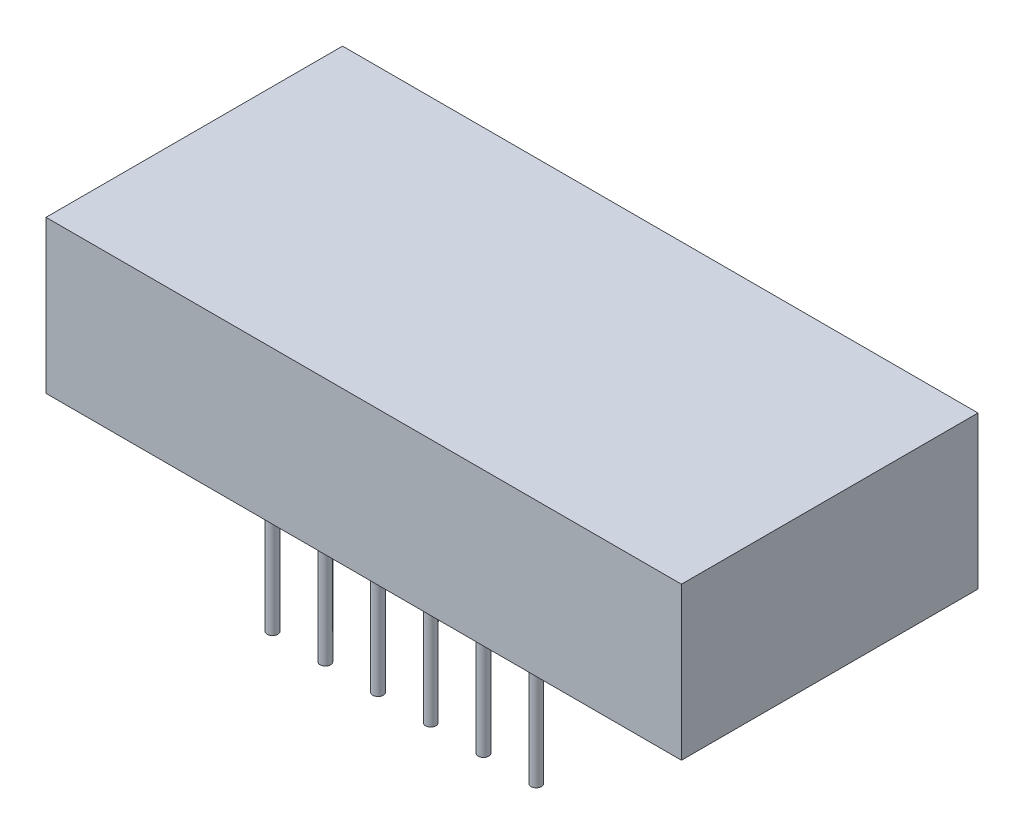
from build123d import *

# Parameters (mm, degrees)
SKETCH_1_W      = 30
SKETCH_1_H      = 14
EXTRUDE_1_DEPTH = 7.2
SKETCH_2_R      = 0.25
EXTRUDE_2_DEPTH = 6.3


with BuildPart() as part:
    # 草图1 → 拉伸1 (new body)
    with BuildSketch(Plane(origin=(0, 0, 0), x_dir=(1, 0, 0), z_dir=(0, 1, 0))):
        Rectangle(SKETCH_1_W, SKETCH_1_H)
    extrude(amount=EXTRUDE_1_DEPTH)

    # 草图2 → 拉伸2 (add)
    with BuildSketch(Plane.XZ):
        with Locations(Location((6.224686657, 5.08, 0), (0, 0, 90))):
            Circle(SKETCH_2_R)
        with Locations(Location((3.734811994, 5.08, 0), (0, 0, 90))):
            Circle(SKETCH_2_R)
        with Locations(Location((1.244937331, 5.08, 0), (0, 0, 90))):
            Circle(SKETCH_2_R)
        with Locations(Location((-1.244937331, 5.08, 0), (0, 0, 90))):
            Circle(SKETCH_2_R)
        with Locations(Location((-3.734811994, 5.08, 0), (0, 0, 90))):
            Circle(SKETCH_2_R)
        with Locations(Location((-6.224686657, 5.08, 0), (0, 0, 90))):
            Circle(SKETCH_2_R)
        with Locations(Location((-6.224686657, -5.08, 0), (0, 0, 90))):
            Circle(SKETCH_2_R)
        with Locations(Location((-3.734811994, -5.08, 0), (0, 0, 90))):
            Circle(SKETCH_2_R)
        with Locations(Location((-1.244937331, -5.08, 0), (0, 0, 90))):
            Circle(SKETCH_2_R)
        with Locations(Location((1.244937331, -5.08, 0), (0, 0, 90))):
            Circle(SKETCH_2_R)
        with Locations(Location((3.734811994, -5.08, 0), (0, 0, 90))):
            Circle(SKETCH_2_R)
        with Locations(Location((6.224686657, -5.08, 0), (0, 0, 90))):
            Circle(SKETCH_2_R)
    extrude(amount=EXTRUDE_2_DEPTH)


solid = part.part
